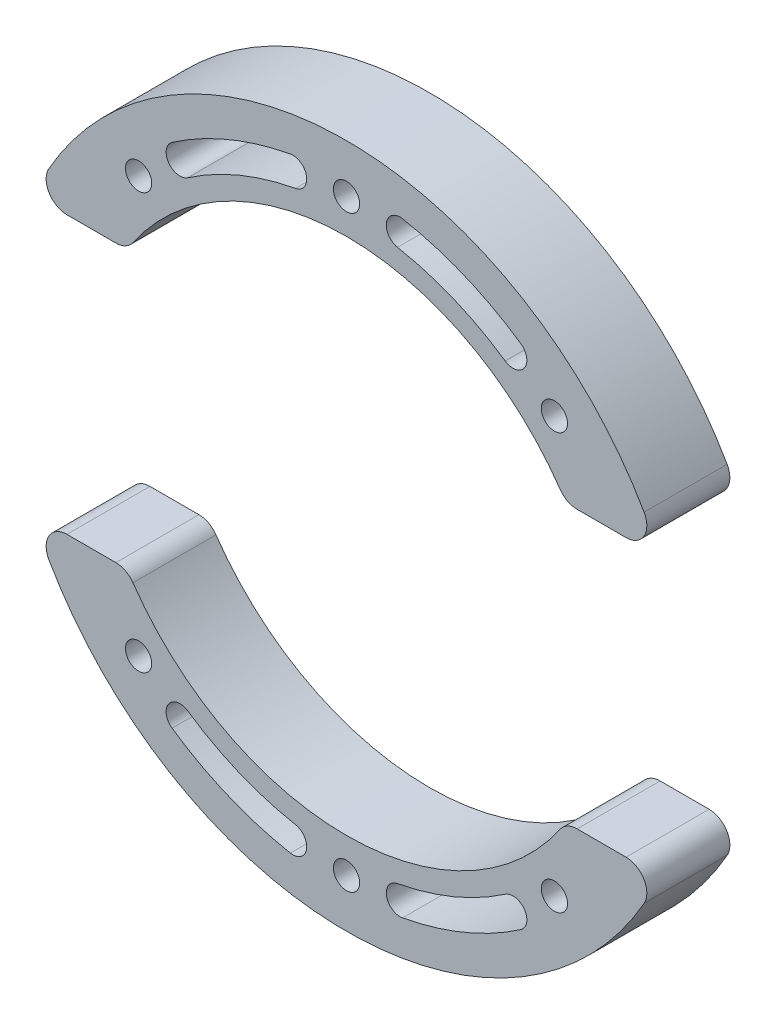
from build123d import *

# Parameters (mm, degrees)
SKETCH_1_R          = 49.5
SKETCH_1_R_2        = 37.5
SKETCH_1_R_3        = 1.9
EXTRUDE_1_DEPTH     = 12
CUT_EXTRUDE_1_DEPTH = 16
SKETCH_4_W          = 99
SKETCH_4_H          = 40
CUT_EXTRUDE_2_DEPTH = 20
FILLET_1_R          = 3
FILLET_2_R          = 3


with BuildPart() as part:
    # 草图1 → 凸台-拉伸1 (new body)
    with BuildSketch(Plane.XY):
        Circle(SKETCH_1_R)
        Circle(SKETCH_1_R_2, mode=Mode.SUBTRACT)
        with Locations((0, 42.5)):
            Circle(SKETCH_1_R_3, mode=Mode.SUBTRACT)
        with Locations((30.0520382, 30.0520382)):
            Circle(SKETCH_1_R_3, mode=Mode.SUBTRACT)
        with Locations((30.0520382, -30.0520382)):
            Circle(SKETCH_1_R_3, mode=Mode.SUBTRACT)
        with Locations((0, -42.5)):
            Circle(SKETCH_1_R_3, mode=Mode.SUBTRACT)
        with Locations((-30.0520382, -30.0520382)):
            Circle(SKETCH_1_R_3, mode=Mode.SUBTRACT)
        with Locations((-30.0520382, 30.0520382)):
            Circle(SKETCH_1_R_3, mode=Mode.SUBTRACT)
        with Locations((-42.5, 0)):
            Circle(SKETCH_1_R_3, mode=Mode.SUBTRACT)
        with Locations((42.5, 0)):
            Circle(SKETCH_1_R_3, mode=Mode.SUBTRACT)
    extrude(amount=EXTRUDE_1_DEPTH)

    # 草图2 → 切除-拉伸1 (cut)
    with BuildSketch(Plane.XY.offset(12)):
        with BuildLine():
            ThreePointArc((-8.109480884, 43.754843387), (-17.02941274, 41.112639197), (-25.205077543, 36.673615394))
            ThreePointArc((-25.205077543, 36.673615394), (-25.720517447, 33.892550543), (-22.939452595, 33.377110639))
            ThreePointArc((-22.939452595, 33.377110639), (-15.498679011, 37.417121067), (-7.380538782, 39.821823756))
            ThreePointArc((-7.380538782, 39.821823756), (-5.778500018, 42.152804622), (-8.109480884, 43.754843387))
        make_face()
        with BuildLine():
            ThreePointArc((25.205077543, 36.673615394), (17.02941274, 41.112639197), (8.109480884, 43.754843387))
            ThreePointArc((8.109480884, 43.754843387), (5.778500018, 42.152804622), (7.380538782, 39.821823756))
            ThreePointArc((7.380538782, 39.821823756), (15.498679011, 37.417121067), (22.939452595, 33.377110639))
            ThreePointArc((22.939452595, 33.377110639), (25.720517447, 33.892550543), (25.205077543, 36.673615394))
        make_face()
        with BuildLine():
            ThreePointArc((8.109480884, -43.754843387), (17.02941274, -41.112639197), (25.205077543, -36.673615394))
            ThreePointArc((25.205077543, -36.673615394), (25.720517447, -33.892550543), (22.939452595, -33.377110639))
            ThreePointArc((22.939452595, -33.377110639), (15.498679011, -37.417121067), (7.380538782, -39.821823756))
            ThreePointArc((7.380538782, -39.821823756), (5.778500018, -42.152804622), (8.109480884, -43.754843387))
        make_face()
        with BuildLine():
            ThreePointArc((-25.205077543, -36.673615394), (-17.02941274, -41.112639197), (-8.109480884, -43.754843387))
            ThreePointArc((-8.109480884, -43.754843387), (-5.778500018, -42.152804622), (-7.380538782, -39.821823756))
            ThreePointArc((-7.380538782, -39.821823756), (-15.498679011, -37.417121067), (-22.939452595, -33.377110639))
            ThreePointArc((-22.939452595, -33.377110639), (-25.720517447, -33.892550543), (-25.205077543, -36.673615394))
        make_face()
    extrude(amount=-CUT_EXTRUDE_1_DEPTH, mode=Mode.SUBTRACT)

    # 草图4 → 切除-拉伸2 (cut)
    with BuildSketch(Plane.XY.offset(12)):
        Rectangle(SKETCH_4_W, SKETCH_4_H)
    extrude(amount=-CUT_EXTRUDE_2_DEPTH, mode=Mode.SUBTRACT)


with BuildPart() as cut_extrude_2_piece_1:
    # of the separate pieces the step leaves, piece 1, a body of its own (cut_extrude_2_pieces)
    add(part.part.solids().sort_by_distance((45.279686395, 20, 0))[0])

    # 圆角1
    fillet_1_edges = [cut_extrude_2_piece_1.edges().sort_by_distance(p)[0] for p in [
        (-31.721443851, 20, 6),
        (31.721443851, 20, 6),
        (45.279686395, 20, 6),
        (-45.279686395, 20, 6),
    ]]
    fillet(fillet_1_edges, radius=FILLET_1_R)


with BuildPart() as cut_extrude_2_piece_2:
    # of the separate pieces the step leaves, piece 2, a body of its own (cut_extrude_2_pieces)
    add(part.part.solids().sort_by_distance((-45.279686395, -20, 0))[0])

    # 圆角2
    fillet_2_edges = [cut_extrude_2_piece_2.edges().sort_by_distance(p)[0] for p in [
        (-45.279686395, -20, 6),
        (45.279686395, -20, 6),
        (31.721443851, -20, 6),
        (-31.721443851, -20, 6),
    ]]
    fillet(fillet_2_edges, radius=FILLET_2_R)


solid = Compound([cut_extrude_2_piece_1.part, cut_extrude_2_piece_2.part])
